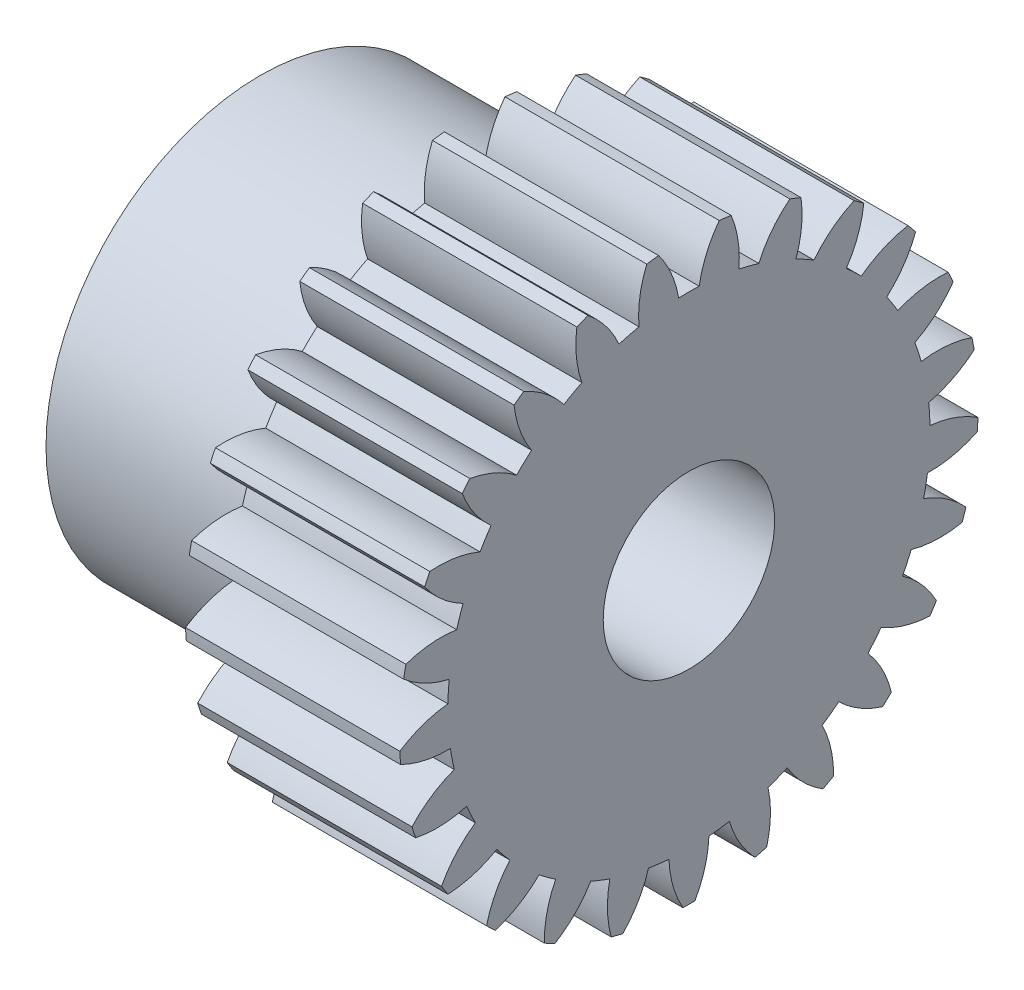
from build123d import *

# Parameters (mm, degrees)
BASPROSKE_W      = 10
BASPROSKE_H      = 13.5
TOOTHCUT_DEPTH   = 22.552262062
TEETHCUTS_COUNT  = 25
TEETHCUTS_ANGLE  = 345.6
HUBNEAONESKE_R   = 10
HUBNEARONE_DEPTH = 10.0000508
BORSKE_R         = 4
BORE_DEPTH       = 20.0000508


with BuildPart() as part:
    # BasProSke → Base-Revolve (revolve)
    with BuildSketch(Plane(origin=(0, 0, 0), x_dir=(1, 0, 0), z_dir=(0, 1, 0)), mode=Mode.PRIVATE) as base_revolve_sk:
        with Locations((5, 6.75)):
            Rectangle(BASPROSKE_W, BASPROSKE_H)
    revolve(base_revolve_sk.sketch.rotate(Axis((-10, 0, 0), (1, 0, 0)), 180), axis=Axis((-10, 0, 0), (1, 0, 0)))

    # TooCutSke → ToothCut (cut, through all)
    with BuildSketch(Plane(origin=(0, 0, 0), x_dir=(0, 0, -1), z_dir=(1, 0, 0))):
        with BuildLine():
            ThreePointArc((0.480087995, 11.238750665), (0, 11.249), (-0.480087995, 11.238750665))
            ThreePointArc((-0.480087995, 11.238750665), (-0.821124963, 12.40220054), (-1.432168974, 13.449361962))
            ThreePointArc((-1.432168974, 13.449361962), (0, 13.5254), (1.432168974, 13.449361962))
            ThreePointArc((1.432168974, 13.449361962), (0.821124963, 12.40220054), (0.480087995, 11.238750665))
        make_face()
    toothcut = extrude(amount=TOOTHCUT_DEPTH, mode=Mode.SUBTRACT)

    # TeethCuts: ToothCut ×25 about axis
    teethcuts_axis = Axis((-10, 0, 0), (1, 0, 0))
    for i in range(1, TEETHCUTS_COUNT):
        add(toothcut.rotate(teethcuts_axis, i * TEETHCUTS_ANGLE / (TEETHCUTS_COUNT - 1)), mode=Mode.SUBTRACT)

    # HubNeaOneSke → HubNearOne (add)
    with BuildSketch(Plane.ZY):
        with Locations(Location((0, 0, 0), (0, 0, 180))):
            Circle(HUBNEAONESKE_R)
    extrude(amount=HUBNEARONE_DEPTH)

    # BorSke → Bore (cut, symmetric)
    with BuildSketch(Plane(origin=(0, 0, 0), x_dir=(0, 0, -1), z_dir=(1, 0, 0))):
        with Locations(Location((0, 0, 0), (0, 0, 180))):
            Circle(BORSKE_R)
    extrude(amount=BORE_DEPTH, both=True, mode=Mode.SUBTRACT)


solid = part.part
